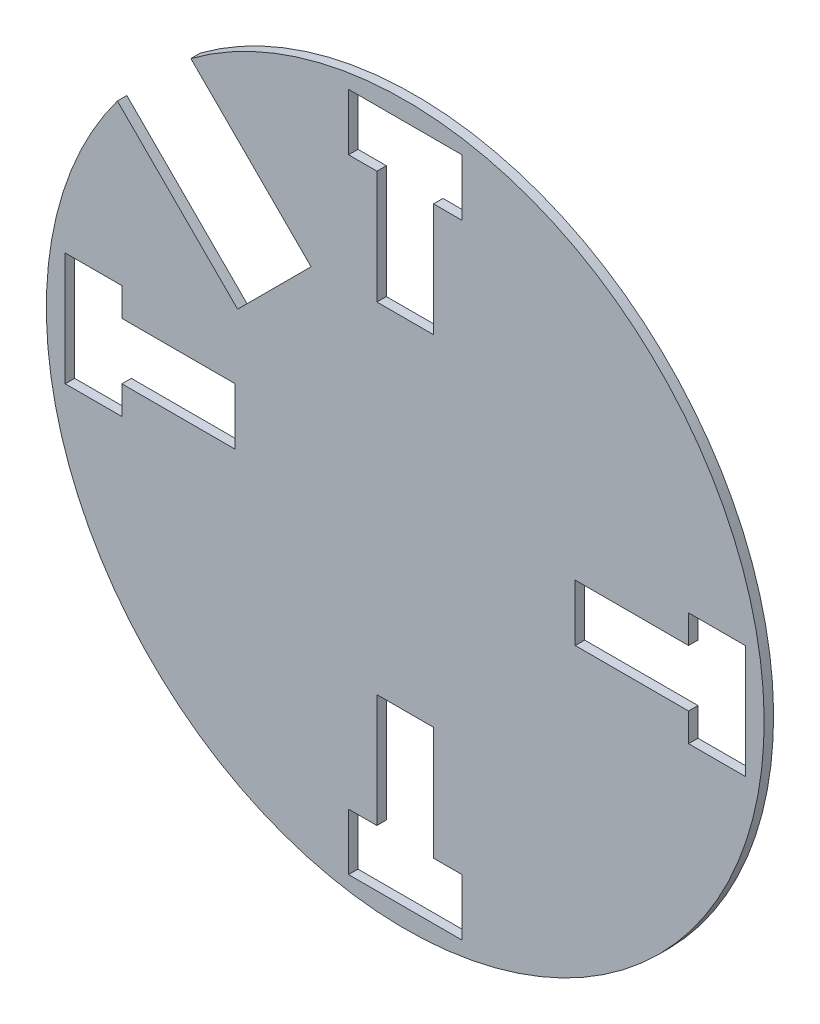
from build123d import *

# Parameters (mm, degrees)
ESQUISSE1_R             = 190
BOSS_EXTRU_1_DEPTH      = 5
ENL_V_MAT_EXTRU_1_DEPTH = 5
ENL_V_MAT_EXTRU_2_DEPTH = 10


with BuildPart() as part:
    # Esquisse1 → Boss.-Extru.1 (new body)
    with BuildSketch(Plane.XY):
        Circle(ESQUISSE1_R)
    extrude(amount=-BOSS_EXTRU_1_DEPTH)

    # Esquisse2 → Enlèv. mat.-Extru.1 (cut)
    with BuildSketch(Plane.XY):
        Polygon((-15, 150), (-15, 90), (15, 90), (15, 150), (30, 150), (30, 180), (-30, 180), (-30, 150), align=None)
        Polygon((30, -180), (30, -150), (15, -150), (15, -90), (-15, -90), (-15, -150), (-30, -150), (-30, -180), align=None)
        Polygon((180, 30), (150, 30), (150, 15), (90, 15), (90, -15), (150, -15), (150, -30), (180, -30), align=None)
        Polygon((-180, -30), (-150, -30), (-150, -15), (-90, -15), (-90, 15), (-150, 15), (-150, 30), (-180, 30), align=None)
    extrude(amount=-ENL_V_MAT_EXTRU_1_DEPTH, mode=Mode.SUBTRACT)

    # Esquisse3 → Enlèv. mat.-Extru.2 (cut)
    with BuildSketch(Plane.XY):
        Polygon((-88.741430887, 49.850557922), (-49.850557922, 88.741430887), (-113.490168229, 152.381041194), (-120.561236041, 159.452109006), (-159.452109006, 120.561236041), (-152.381041194, 113.490168229), align=None)
    extrude(amount=-ENL_V_MAT_EXTRU_2_DEPTH, mode=Mode.SUBTRACT)


solid = part.part
